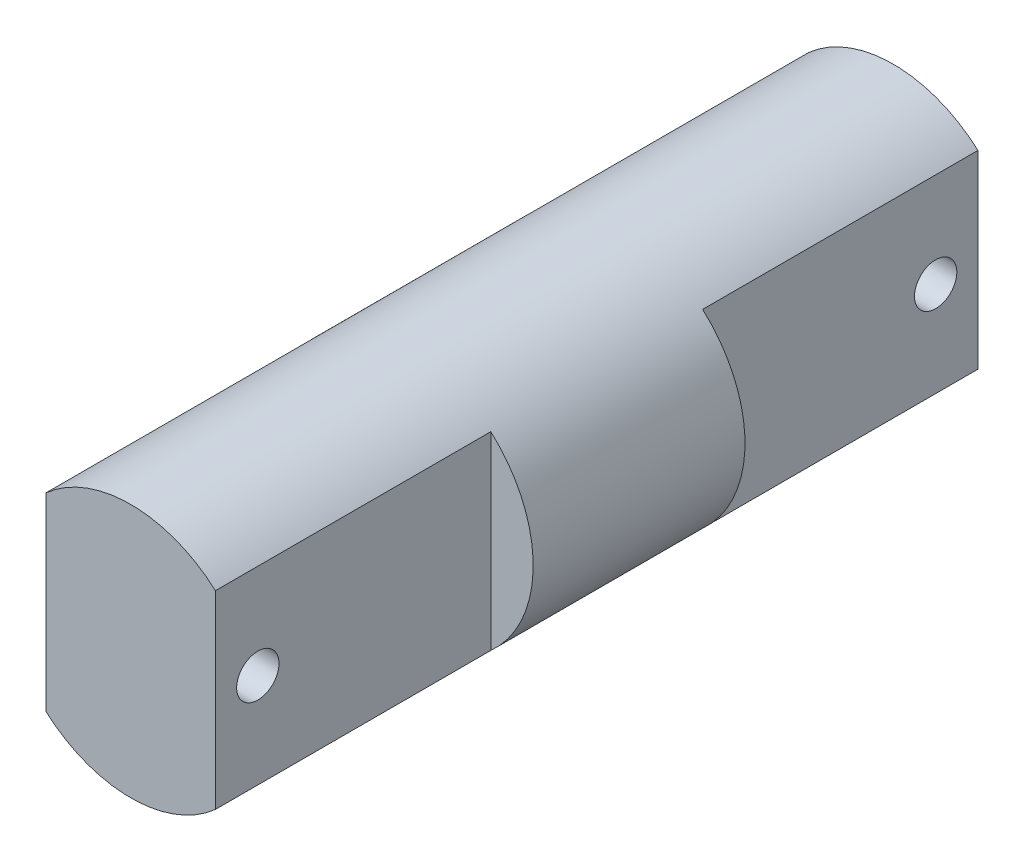
from build123d import *

# Parameters (mm, degrees)
SKETCH2_R           = 38.1
BOSS_EXTRUDE1_DEPTH = 228.6
CUT_EXTRUDE1_START  = 25.4
SKETCH3_W           = 165.1
SKETCH3_H           = 76.2
CUT_EXTRUDE1_DEPTH  = 25.4
CUT_EXTRUDE2_START  = -25.4
SKETCH3_2_W         = 165.1
SKETCH3_2_H         = 76.2
CUT_EXTRUDE2_DEPTH  = 25.4
CUT_EXTRUDE3_REACH  = 242.295
SKETCH4_R           = 6.35


with BuildPart() as part:
    # Sketch2 → Boss-Extrude1 (new body)
    with BuildSketch(Plane.XY):
        Circle(SKETCH2_R)
    extrude(amount=-BOSS_EXTRUDE1_DEPTH)

    # Sketch3 → Cut-Extrude1 (cut)
    with BuildSketch(Plane(origin=(0, 0, 0), x_dir=(0, 0, -1), z_dir=(1, 0, 0)).offset(CUT_EXTRUDE1_START)):
        Rectangle(SKETCH3_W, SKETCH3_H)
    cut_extrude1 = extrude(amount=CUT_EXTRUDE1_DEPTH, mode=Mode.SUBTRACT)

    # Sketch3<2> → Cut-Extrude2 (cut)
    with BuildSketch(Plane(origin=(0, 0, 0), x_dir=(0, 0, -1), z_dir=(1, 0, 0)).offset(CUT_EXTRUDE2_START)):
        Rectangle(SKETCH3_2_W, SKETCH3_2_H)
    cut_extrude2 = extrude(amount=-CUT_EXTRUDE2_DEPTH, mode=Mode.SUBTRACT)

    # Sketch4 → Cut-Extrude3 (cut, up to next)
    with BuildSketch(Plane(origin=(25.4, 0, 0), x_dir=(0, 0, -1), z_dir=(1, 0, 0)), mode=Mode.PRIVATE) as cut_extrude3_sk1:
        with Locations((12.7, 0)):
            Circle(SKETCH4_R)
    cut_extrude3_tool1 = extrude(cut_extrude3_sk1.sketch, amount=-CUT_EXTRUDE3_REACH, mode=Mode.PRIVATE) & part.part
    cut_extrude3 = cut_extrude3_tool1.solids().sort_by_distance((25.4, 0, -12.7))[0]
    add(cut_extrude3, mode=Mode.SUBTRACT)

    # Mirror1: Cut-Extrude1, Cut-Extrude2, Cut-Extrude3 across plane
    add(cut_extrude1.mirror(Plane.XY.offset(-114.3)), mode=Mode.SUBTRACT)
    add(cut_extrude2.mirror(Plane.XY.offset(-114.3)), mode=Mode.SUBTRACT)
    add(cut_extrude3.mirror(Plane.XY.offset(-114.3)), mode=Mode.SUBTRACT)


solid = part.part
